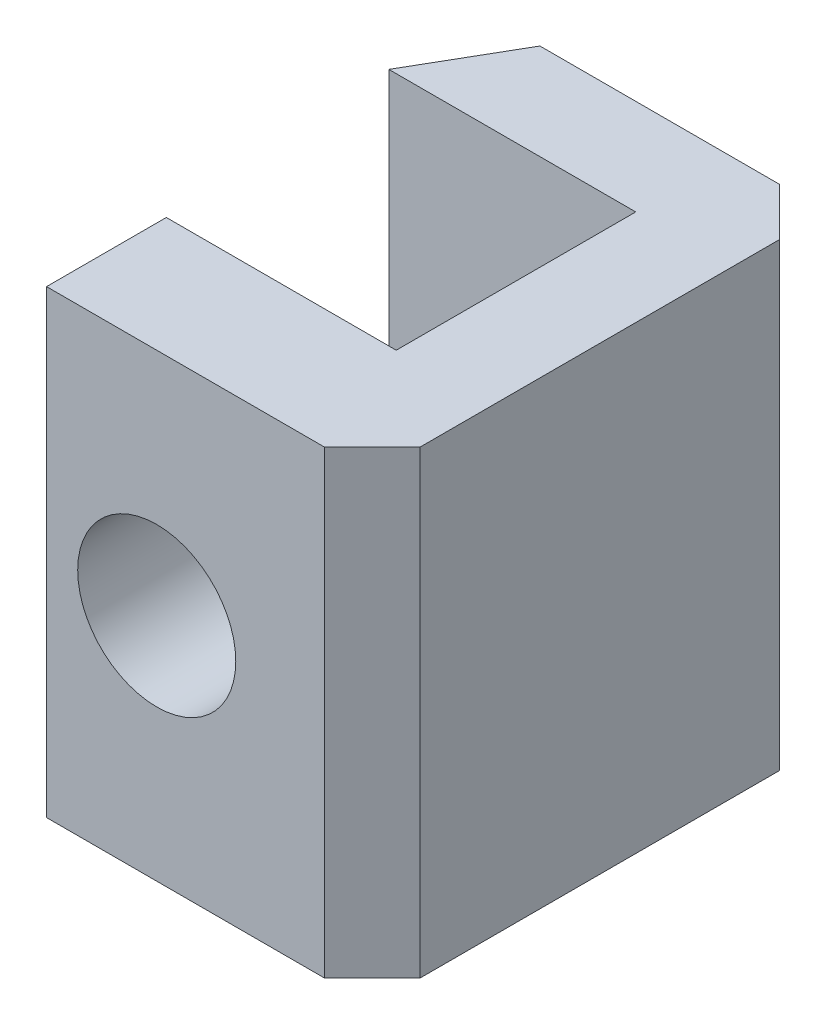
from build123d import *

# Parameters (mm, degrees)
BOSS_EXTRUDE1_START = 0.2
BOSS_EXTRUDE1_DEPTH = 9.6
SKETCH3_R           = 1.65
CUT_EXTRUDE1_DEPTH  = 5
CHAMFER1_SIZE       = 1


with BuildPart() as part:
    # Sketch2 → Boss-Extrude1 (new body)
    with BuildSketch(Plane.XZ.offset(17.988801204).offset(BOSS_EXTRUDE1_START)):
        Polygon((26.026797653, -5), (31.181498191, -5), (31.181498191, -2.5), (31.181498191, 0), (26.381498191, 0), (26.381498191, 2.5), (33.181498191, 2.5), (33.181498191, -7), (27.181498191, -7), align=None)
    extrude(amount=BOSS_EXTRUDE1_DEPTH)

    # Sketch3 → Cut-Extrude1 (cut)
    with BuildSketch(Plane.XY.offset(2.5)):
        with Locations((28.681498191, -22.988801204)):
            Circle(SKETCH3_R)
    extrude(amount=-CUT_EXTRUDE1_DEPTH, mode=Mode.SUBTRACT)

    # Chamfer1
    chamfer1_edges = [part.edges().sort_by_distance(p)[0] for p in [
        (33.181498191, -22.988801204, -7),
        (33.181498191, -22.988801204, 2.5),
    ]]
    chamfer(chamfer1_edges, length=CHAMFER1_SIZE)


solid = part.part
